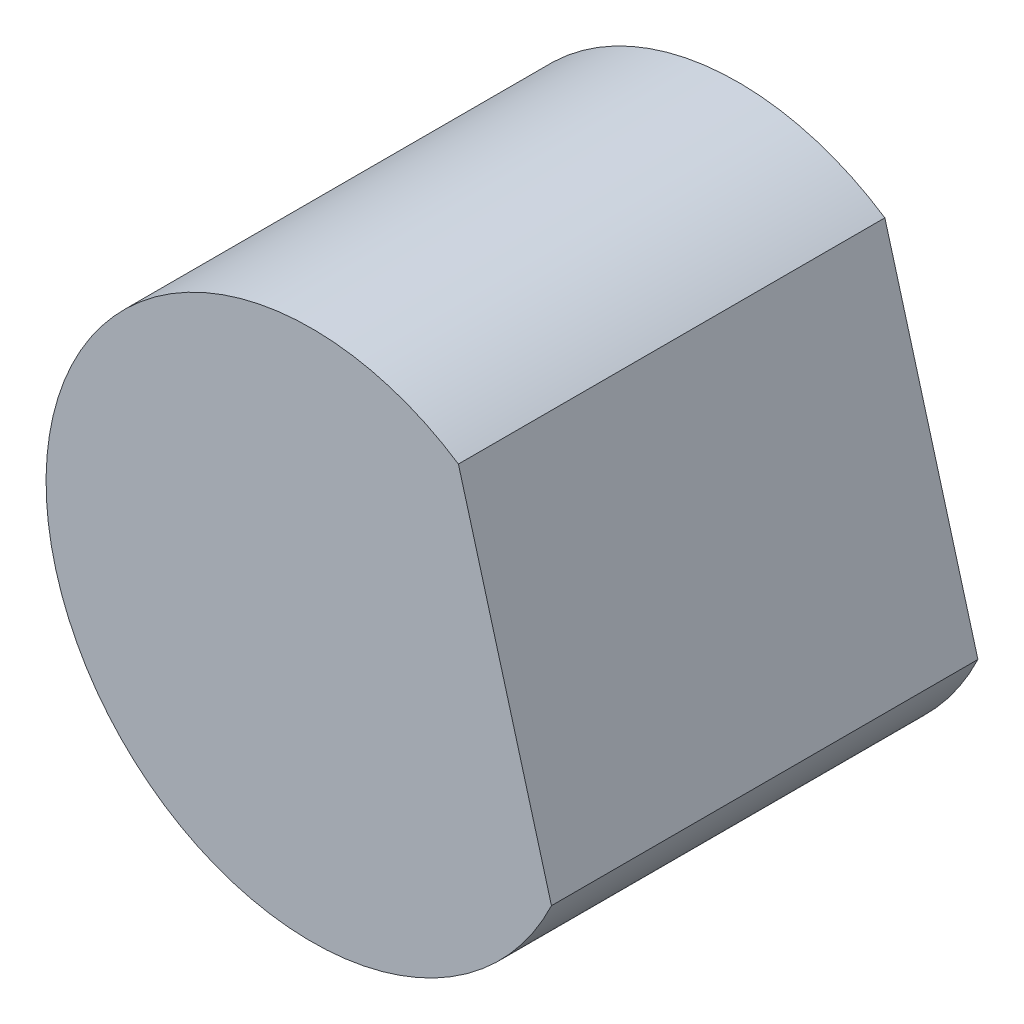
from build123d import *

# Parameters (mm, degrees)
SKETCH2_R           = 38
BOSS_EXTRUDE1_DEPTH = 61
CUT_EXTRUDE1_DEPTH  = 61


with BuildPart() as part:
    # Sketch2 → Boss-Extrude1 (new body)
    with BuildSketch(Plane.XY):
        with Locations(Location((0, 0, 0), (0, 0, 180))):
            Circle(SKETCH2_R)
    extrude(amount=BOSS_EXTRUDE1_DEPTH)

    # Sketch3 → Cut-Extrude1 (cut)
    with BuildSketch(Plane(origin=(0, 0, 0), x_dir=(-1, 0, 0), z_dir=(0, 0, -1))):
        with BuildLine():
            Line((-34.292009263, -16.372479981), (-20.983055337, 31.681404463))
            ThreePointArc((-20.983055337, 31.681404463), (-36.621402815, 10.142625688), (-34.292009263, -16.372479981))
        make_face()
    extrude(amount=-CUT_EXTRUDE1_DEPTH, mode=Mode.SUBTRACT)


solid = part.part
